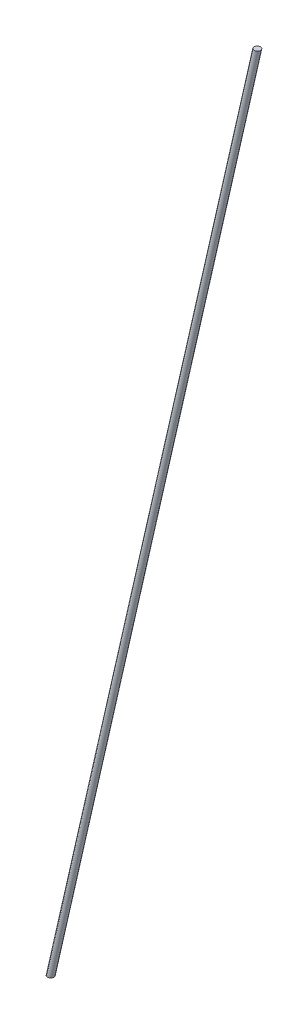
from build123d import *

# Parameters (mm, degrees)
SKETCH2_R = 2


with BuildPart() as part:
    # Sweep1: sweep along a path in Sketch1
    with BuildLine(Plane.XY) as sweep1_path:
        Line((-130, -570), (0, 0))
    # Sketch2 → Sweep1 (sweep)
    with BuildSketch(Plane(origin=(0, 0, 0), x_dir=(1, 0, 0), z_dir=(0, 1, 0))):
        Circle(SKETCH2_R)
    sweep(path=sweep1_path.line)


solid = part.part
